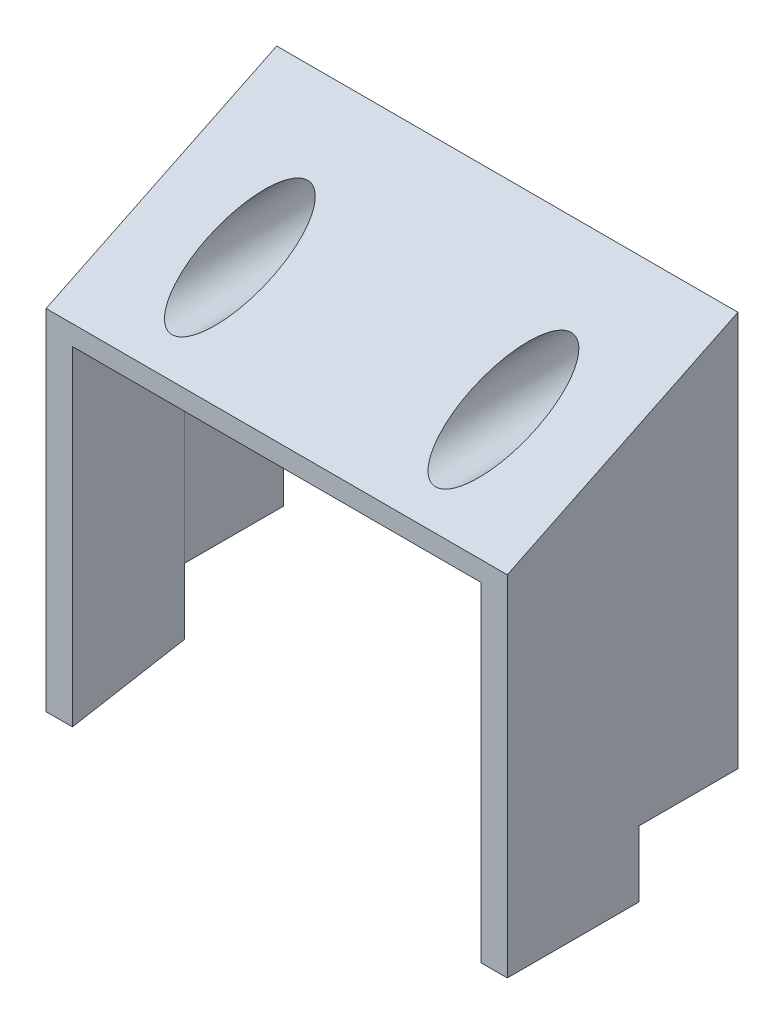
from build123d import *

# Parameters (mm, degrees)
SKETCH_1_W          = 70
SKETCH_1_H          = 20
SKETCH_1_R          = 3
EXTRUDE_1_DEPTH     = 3
SKETCH_3_W          = 70
SKETCH_3_H          = 35
EXTRUDE_2_DEPTH     = 3
EXTRUDE_3_DEPTH     = 50
EXTRUDE_4_DEPTH     = 70
SKETCH_6_R          = 5
CUT_EXTRUDE_3_DEPTH = 30
CUT_EXTRUDE_4_DEPTH = 70
SKETCH_8_W          = 15
SKETCH_8_H          = 10
CUT_EXTRUDE_5_DEPTH = 99.615414617


with BuildPart() as part:
    # 草图1 → 凸台-拉伸1 (new body)
    with BuildSketch(Plane.XY):
        Rectangle(SKETCH_1_W, SKETCH_1_H)
        with Locations((-20, 0)):
            Circle(SKETCH_1_R, mode=Mode.SUBTRACT)
        with Locations((20, 0)):
            Circle(SKETCH_1_R, mode=Mode.SUBTRACT)
    extrude(amount=EXTRUDE_1_DEPTH)

    # 草图3 → 凸台-拉伸2 (add)
    with BuildSketch(Plane.XZ.offset(10)):
        with Locations((0, 17.5)):
            Rectangle(SKETCH_3_W, SKETCH_3_H)
    extrude(amount=-EXTRUDE_2_DEPTH)

    # 草图4 → 凸台-拉伸3 (add)
    with BuildSketch(Plane.XZ.offset(10)):
        Polygon((-34, 15), (-31, 35), (-35, 35), (-35, 15), (-35, 0), (-34, 0), align=None)
        Polygon((35, 0), (34, 0), (34, 15), (31, 35), (35, 35), (35, 15), align=None)
    extrude(amount=EXTRUDE_3_DEPTH)

    # 草图5 → 凸台-拉伸4 (add)
    with BuildSketch(Plane.ZY.offset(35)):
        Polygon((3, 10), (3, -7), (35, -7), align=None)
    extrude(amount=-EXTRUDE_4_DEPTH)

    # 草图6 → 切除-拉伸3 (cut)
    with BuildSketch(Plane(origin=(0, 0, 3), x_dir=(-1, 0, 0), z_dir=(0, 0, -1))):
        with Locations((-20, 0)):
            Circle(SKETCH_6_R)
        with Locations((20, 0)):
            Circle(SKETCH_6_R)
    extrude(amount=-CUT_EXTRUDE_3_DEPTH, mode=Mode.SUBTRACT)

    # 草图7 → 切除-拉伸4 (cut)
    with BuildSketch(Plane.ZY.offset(35)):
        Polygon((0, 10), (35, -7), (3, 10), align=None)
    extrude(amount=-CUT_EXTRUDE_4_DEPTH, mode=Mode.SUBTRACT)

    # 草图8 → 切除-拉伸5 (cut, through all)
    with BuildSketch(Plane.ZY.offset(35)):
        with Locations((7.5, -55)):
            Rectangle(SKETCH_8_W, SKETCH_8_H)
    extrude(amount=-CUT_EXTRUDE_5_DEPTH, mode=Mode.SUBTRACT)


solid = part.part
